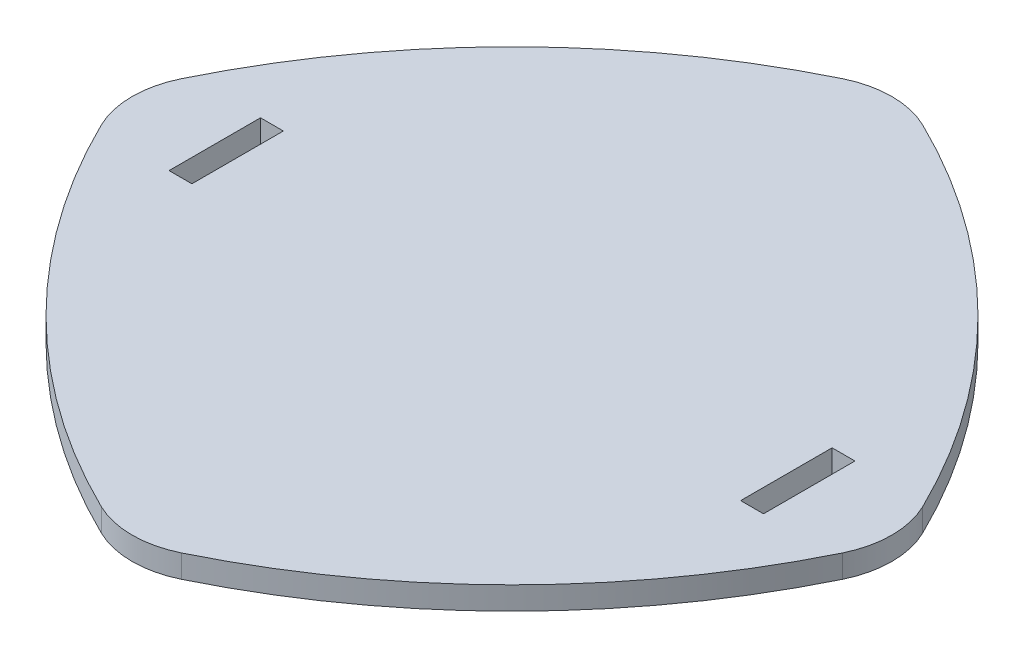
from build123d import *

# Parameters (mm, degrees)
BOSS_EXTRUDE1_DEPTH = 0.25
FILLET1_R           = 2
CUT_EXTRUDE1_REACH  = 13.759
SKETCH2_W           = 0.5
SKETCH2_H           = 2


with BuildPart() as part:
    # Sketch1 → Boss-Extrude1 (new, symmetric)
    with BuildSketch(Plane(origin=(0, 0, 0), x_dir=(1, 0, 0), z_dir=(0, 1, 0))):
        with BuildLine():
            ThreePointArc((-8.5, 0), (-5.095377561, 5.095377561), (0, 8.5))
            ThreePointArc((0, 8.5), (5.095377561, 5.095377561), (8.5, 0))
            ThreePointArc((8.5, 0), (5.095377561, -5.095377561), (0, -8.5))
            ThreePointArc((0, -8.5), (-5.095377561, -5.095377561), (-8.5, 0))
        make_face()
    extrude(amount=BOSS_EXTRUDE1_DEPTH, both=True)

    # Fillet1
    fillet1_edges = [part.edges().sort_by_distance(p)[0] for p in [
        (-8.5, 0, 0),
        (0, 0, -8.5),
        (8.5, 0, 0),
        (0, 0, 8.5),
    ]]
    fillet(fillet1_edges, radius=FILLET1_R)

    # Sketch2 → Cut-Extrude1 (cut, up to next)
    with BuildSketch(Plane(origin=(0, 0.25, 0), x_dir=(1, 0, 0), z_dir=(0, 1, 0)), mode=Mode.PRIVATE) as cut_extrude1_sk1:
        with Locations((-6.25, 0)):
            Rectangle(SKETCH2_W, SKETCH2_H)
    cut_extrude1_tool1 = extrude(cut_extrude1_sk1.sketch, amount=-CUT_EXTRUDE1_REACH, mode=Mode.PRIVATE) & part.part
    # Sketch2 → Cut-Extrude1 (cut, up to next)
    with BuildSketch(Plane(origin=(0, 0.25, 0), x_dir=(1, 0, 0), z_dir=(0, 1, 0)), mode=Mode.PRIVATE) as cut_extrude1_sk2:
        with Locations((6.25, 0)):
            Rectangle(SKETCH2_W, SKETCH2_H)
    cut_extrude1_tool2 = extrude(cut_extrude1_sk2.sketch, amount=-CUT_EXTRUDE1_REACH, mode=Mode.PRIVATE) & part.part
    add(cut_extrude1_tool1.solids().sort_by_distance((-6.25, 0.25, 0))[0], mode=Mode.SUBTRACT)
    add(cut_extrude1_tool2.solids().sort_by_distance((6.25, 0.25, 0))[0], mode=Mode.SUBTRACT)


solid = part.part
